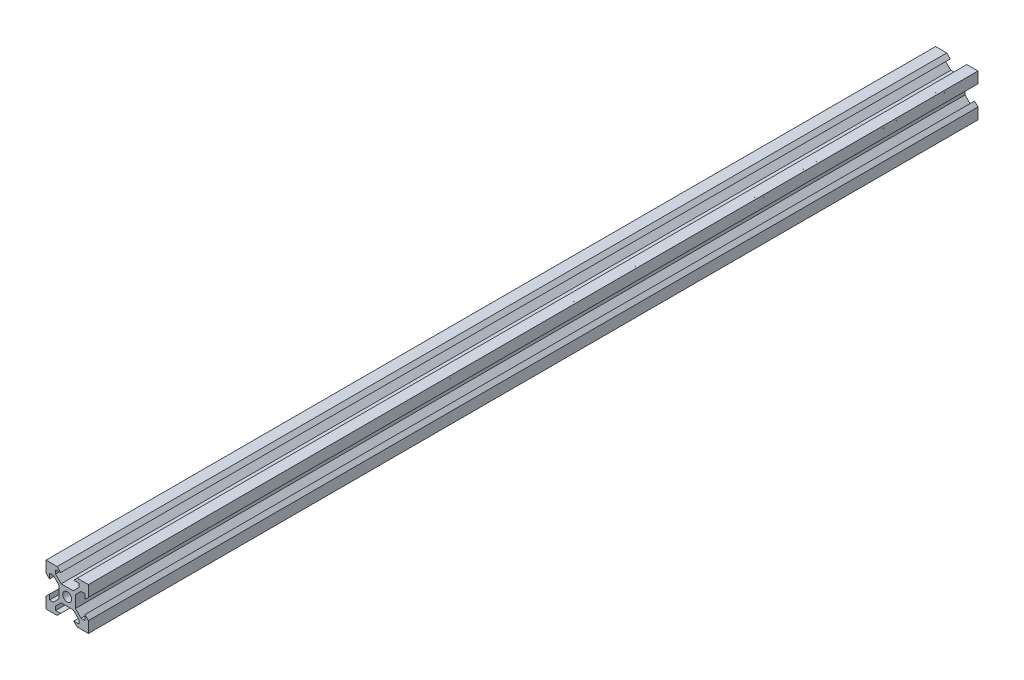
from build123d import *

# Parameters (mm, degrees)
SKETCH1_R           = 2.1
BOSS_EXTRUDE1_DEPTH = 420


with BuildPart() as part:
    # Sketch1 → Boss-Extrude1 (new body)
    with BuildSketch(Plane.XY):
        Polygon((2.834320347, 3.893970342), (5.5, 6.558849663), (5.5, 8.349069506), (3.1, 8.349069506), (4.75, 9.998574117), (10, 9.998574117), (10, 4.746997406), (8.35, 3.097492795), (8.350720674, 5.497492687), (6.560500912, 5.498030255), (3.894821259, 2.833150935), (3.894821259, -2.833150935), (6.560500912, -5.498030255), (8.350720674, -5.497492687), (8.35, -3.097492795), (10, -4.746997406), (10, -9.998574117), (4.75, -9.998574117), (3.1, -8.349069506), (5.5, -8.349069506), (5.5, -6.558849663), (2.834320347, -3.893970342), (-2.834320347, -3.893970342), (-5.5, -6.558849663), (-5.5, -8.349069506), (-3.1, -8.349069506), (-4.75, -9.998574117), (-10, -9.998574117), (-10, -4.746997406), (-8.35, -3.097492795), (-8.350720674, -5.497492687), (-6.560500912, -5.498030255), (-3.894821259, -2.833150935), (-3.894821259, 2.833150935), (-6.560500912, 5.498030255), (-8.350720674, 5.497492687), (-8.35, 3.097492795), (-10, 4.746997406), (-10, 9.998574117), (-4.75, 9.998574117), (-3.1, 8.349069506), (-5.5, 8.349069506), (-5.5, 6.558849663), (-2.834320347, 3.893970342), align=None)
        Circle(SKETCH1_R, mode=Mode.SUBTRACT)
    extrude(amount=BOSS_EXTRUDE1_DEPTH)


solid = part.part
